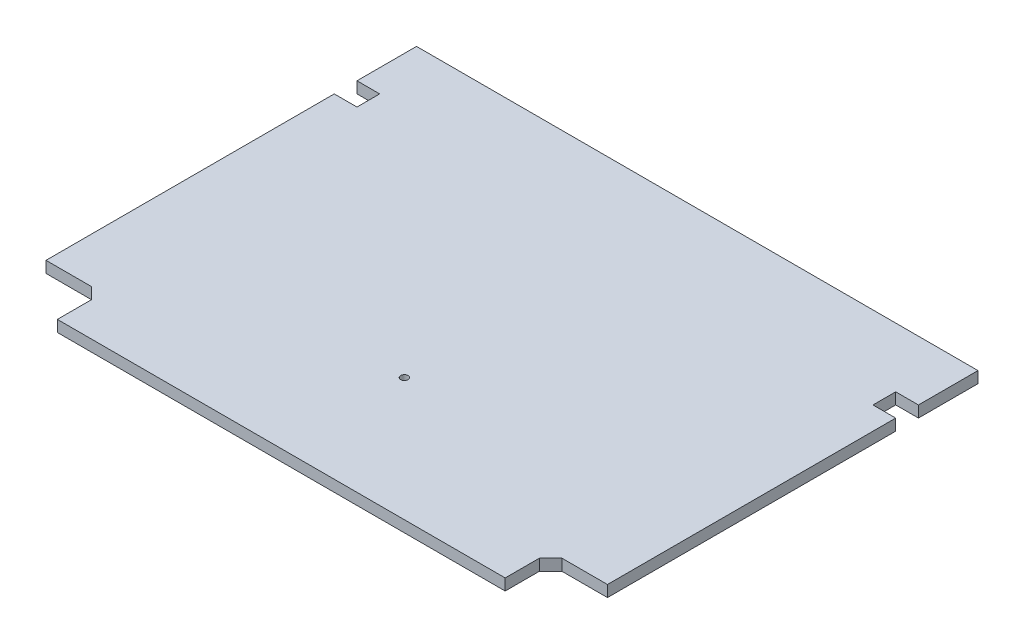
from build123d import *

# Parameters (mm, degrees)
ESQUISSE1_R        = 1.6
BOSS_EXTRU_1_DEPTH = 5


with BuildPart() as part:
    # Esquisse1 → Boss.-Extru.1 (new body)
    with BuildSketch(Plane(origin=(0, 0, 0), x_dir=(1, 0, 0), z_dir=(0, 1, 0))):
        Polygon((-123.5, 5), (123.5, 5), (123.5, -21.2), (113.5, -21.2), (113.5, -31.2), (123.5, -31.2), (123.5, -158), (103.5, -158), (98.5, -163), (98.5, -178), (-98.5, -178), (-98.5, -163), (-103.5, -158), (-123.5, -158), (-123.5, -31.2), (-113.5, -31.2), (-113.5, -21.2), (-123.5, -21.2), align=None)
        with Locations(Location((0, -123.86, 0), (0, 0, 270))):
            Circle(ESQUISSE1_R, mode=Mode.SUBTRACT)
    extrude(amount=BOSS_EXTRU_1_DEPTH)


solid = part.part
